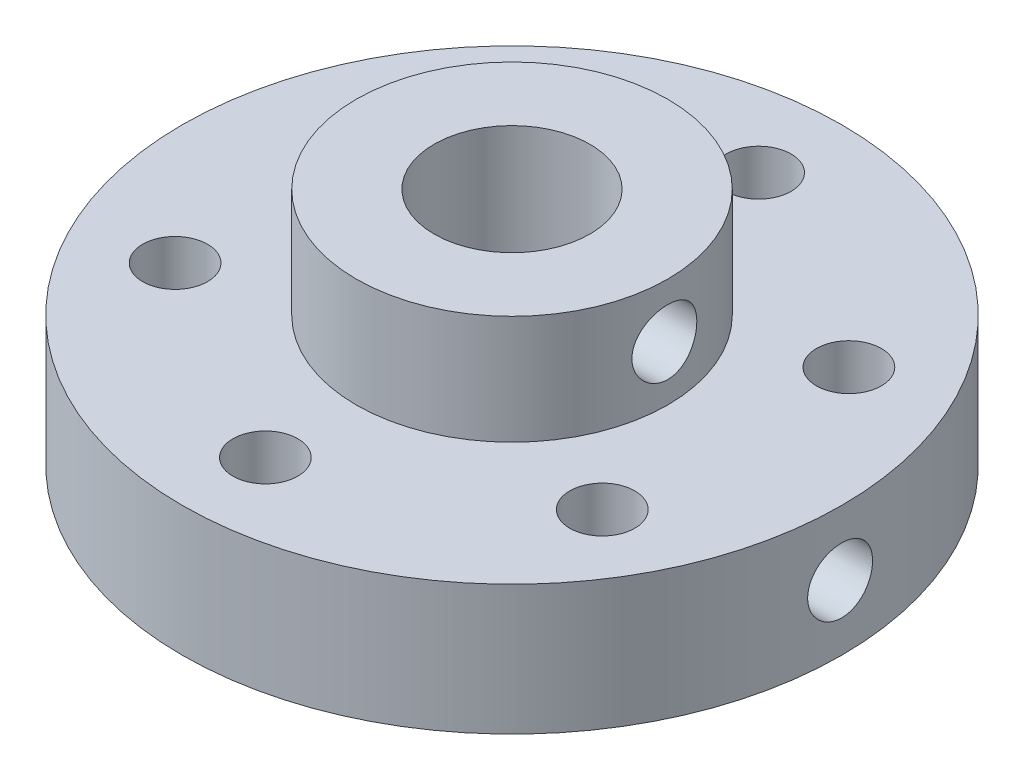
from build123d import *

# Parameters (mm, degrees)
SKETCH1_R                        = 12.7
BOSS_EXTRUDE1_DEPTH              = 5
SKETCH2_R                        = 6
BOSS_EXTRUDE2_DEPTH              = 4.2
SKETCH3_R                        = 3
CUT_EXTRUDE1_DEPTH               = 21.179692763
TAP_DRILL_FOR_M3_TAP1_D          = 2.5
SKETCH8_W                        = 1.25
SKETCH8_H                        = 12.7
TAP_DRILL_FOR_M3_TAP2_AT_2_COUNT = 2
TAP_DRILL_FOR_M3_TAP2_AT_2_PITCH = 4.6


with BuildPart() as part:
    # Sketch1 → Boss-Extrude1 (new body)
    with BuildSketch(Plane(origin=(0, 0, 0), x_dir=(1, 0, 0), z_dir=(0, 1, 0))):
        with Locations(Location((0, 0, 0), (0, 0, 270))):
            Circle(SKETCH1_R)
    extrude(amount=BOSS_EXTRUDE1_DEPTH)

    # Sketch2 → Boss-Extrude2 (add)
    with BuildSketch(Plane(origin=(0, 5, 0), x_dir=(1, 0, 0), z_dir=(0, 1, 0))):
        with Locations(Location((0, 0, 0), (0, 0, 270))):
            Circle(SKETCH2_R)
    extrude(amount=BOSS_EXTRUDE2_DEPTH)

    # Sketch3 → Cut-Extrude1 (cut, through all)
    with BuildSketch(Plane(origin=(0, 9.2, 0), x_dir=(1, 0, 0), z_dir=(0, 1, 0))):
        with Locations(Location((0, 0, 0), (0, 0, 270))):
            Circle(SKETCH3_R)
    extrude(amount=-CUT_EXTRUDE1_DEPTH, mode=Mode.SUBTRACT)

    # Tap Drill for M3 Tap1 (through all)
    with Locations(Plane(origin=(0, 5, 0), x_dir=(1, 0, 0), z_dir=(0, 1, 0))):
        with Locations((-8.227241336, 4.75), (0, 9.5), (8.227241336, 4.75), (8.227241336, -4.75), (0, -9.5), (-8.227241336, -4.75)):
            Hole(TAP_DRILL_FOR_M3_TAP1_D / 2)

    # Sketch8 → Tap Drill for M3 Tap2 (revolve, cut)
    with BuildSketch(Plane.ZX.offset(2.5)):
        with Locations((0.625, 6.35)):
            Rectangle(SKETCH8_W, SKETCH8_H)
    tap_drill_for_m3_tap2 = revolve(axis=Axis((-6.35, 2.5, 0), (1, 0, 0)), mode=Mode.SUBTRACT)

    # Tap Drill for M3 Tap2 at 2: Tap Drill for M3 Tap2 ×2
    with Locations(*[(0, i * TAP_DRILL_FOR_M3_TAP2_AT_2_PITCH, 0) for i in range(1, TAP_DRILL_FOR_M3_TAP2_AT_2_COUNT)]):
        add(tap_drill_for_m3_tap2, mode=Mode.SUBTRACT)


solid = part.part
